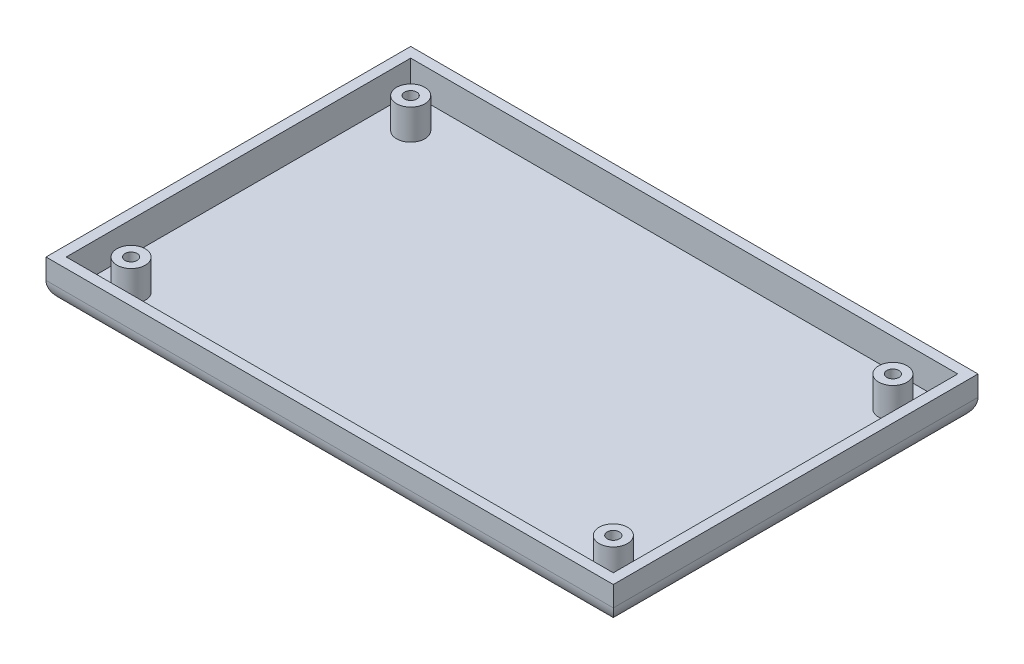
from build123d import *

# Parameters (mm, degrees)
SKETCH1_W           = 140
SKETCH1_H           = 90
BOSS_EXTRUDE2_DEPTH = 10
SKETCH2_W           = 135
SKETCH2_H           = 85
CUT_EXTRUDE1_DEPTH  = 7.5
SKETCH4_R           = 3.5
BOSS_EXTRUDE3_DEPTH = 7.5
SKETCH5_R           = 1.5
CUT_EXTRUDE2_DEPTH  = 167.733320005
FILLET1_R           = 5


with BuildPart() as part:
    # Sketch1 → Boss-Extrude2 (new body)
    with BuildSketch(Plane(origin=(0, 0, 0), x_dir=(1, 0, 0), z_dir=(0, 1, 0))):
        with Locations((70, 45)):
            Rectangle(SKETCH1_W, SKETCH1_H)
    extrude(amount=BOSS_EXTRUDE2_DEPTH)

    # Sketch2 → Cut-Extrude1 (cut)
    with BuildSketch(Plane(origin=(0, 10, 0), x_dir=(1, 0, 0), z_dir=(0, 1, 0))):
        with Locations((70, 45)):
            Rectangle(SKETCH2_W, SKETCH2_H)
    extrude(amount=-CUT_EXTRUDE1_DEPTH, mode=Mode.SUBTRACT)

    # Sketch4 → Boss-Extrude3 (add)
    with BuildSketch(Plane(origin=(0, 2.5, 0), x_dir=(1, 0, 0), z_dir=(0, 1, 0))):
        with Locations(Location((10.5, 79.5, 0), (0, 0, 270))):
            Circle(SKETCH4_R)
        with Locations(Location((10.5, 10.5, 0), (0, 0, 270))):
            Circle(SKETCH4_R)
        with Locations(Location((129.5, 10.5, 0), (0, 0, 270))):
            Circle(SKETCH4_R)
        with Locations(Location((129.5, 79.5, 0), (0, 0, 270))):
            Circle(SKETCH4_R)
    extrude(amount=BOSS_EXTRUDE3_DEPTH)

    # Sketch5 → Cut-Extrude2 (cut, through all)
    with BuildSketch(Plane(origin=(0, 10, 0), x_dir=(1, 0, 0), z_dir=(0, 1, 0))):
        with Locations(Location((10.5, 10.5, 0), (0, 0, 270))):
            Circle(SKETCH5_R)
        with Locations(Location((10.5, 79.5, 0), (0, 0, 270))):
            Circle(SKETCH5_R)
        with Locations(Location((129.5, 79.5, 0), (0, 0, 270))):
            Circle(SKETCH5_R)
        with Locations(Location((129.5, 10.5, 0), (0, 0, 270))):
            Circle(SKETCH5_R)
    extrude(amount=-CUT_EXTRUDE2_DEPTH, mode=Mode.SUBTRACT)

    # Fillet1
    fillet1_edges = [part.edges().sort_by_distance(p)[0] for p in [
        (70, 0, -90),
        (140, 0, -45),
        (70, 0, 0),
        (0, 0, -45),
    ]]
    fillet(fillet1_edges, radius=FILLET1_R)


solid = part.part
